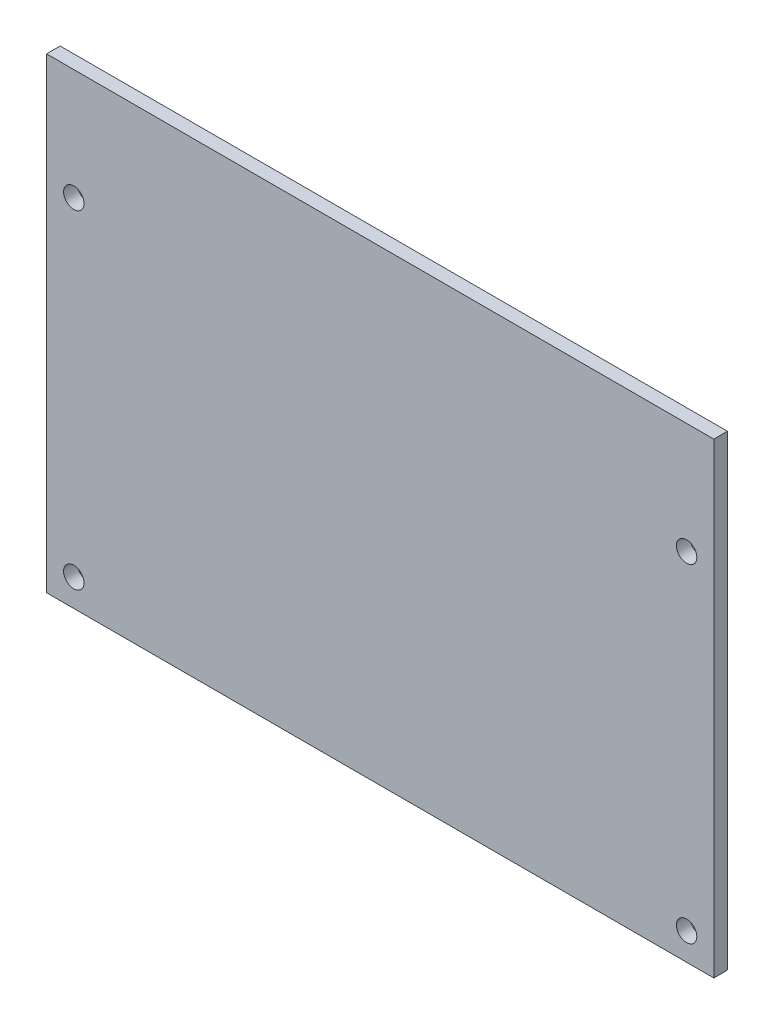
from build123d import *

# Parameters (mm, degrees)
SKETCH_1_W      = 98
SKETCH_1_H      = 68.54231853
SKETCH_1_R      = 1.5
EXTRUDE_1_DEPTH = 2


with BuildPart() as part:
    # 草圖1 → 填料-伸長1 (new body)
    with BuildSketch(Plane.XY):
        with Locations((-12.23282012, 7.416985065)):
            Rectangle(SKETCH_1_W, SKETCH_1_H)
        with Locations((-57.23282012, 25.3958258)):
            Circle(SKETCH_1_R, mode=Mode.SUBTRACT)
        with Locations((-57.23282012, -22.8541742)):
            Circle(SKETCH_1_R, mode=Mode.SUBTRACT)
        with Locations((32.76717988, -22.8541742)):
            Circle(SKETCH_1_R, mode=Mode.SUBTRACT)
        with Locations((32.76717988, 25.3958258)):
            Circle(SKETCH_1_R, mode=Mode.SUBTRACT)
    extrude(amount=EXTRUDE_1_DEPTH)


solid = part.part
